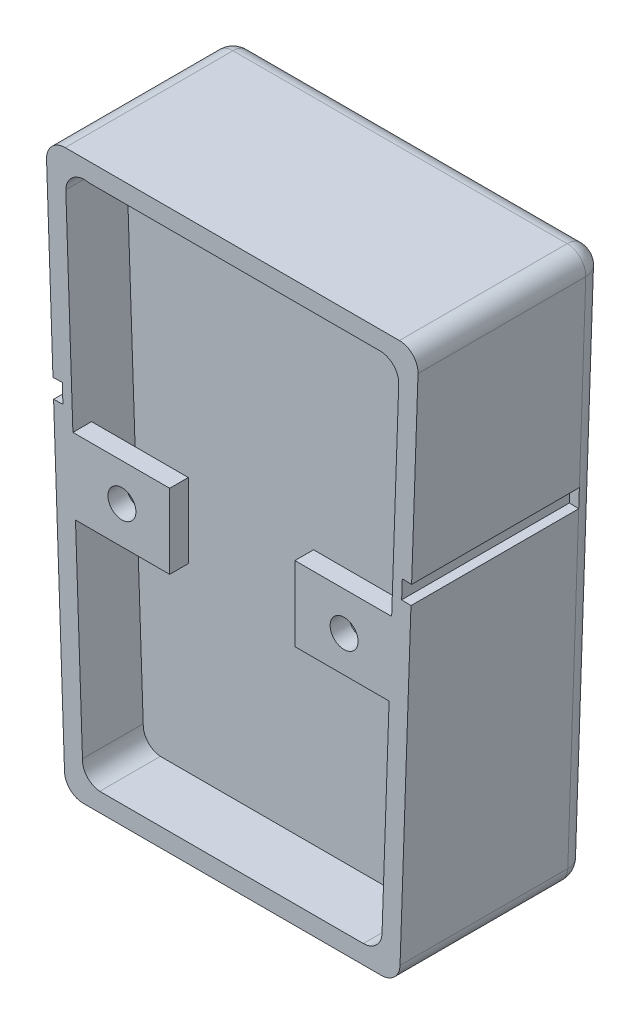
from build123d import *

# Parameters (mm, degrees)
BOSS_EXTRUDE1_DEPTH = 3.81
BOSS_EXTRUDE3_DEPTH = 21.59
BOSS_EXTRUDE4_DEPTH = 2.54
FILLET1_R           = 2.54
BOSS_EXTRUDE6_DEPTH = 2.54
SKETCH9_R           = 1.905
CUT_EXTRUDE1_DEPTH  = 2.54
CUT_EXTRUDE2_DEPTH  = 1.27
SKETCH11_W          = 22.86
SKETCH11_H          = 2.54
CUT_EXTRUDE3_DEPTH  = 1.27
SKETCH12_W          = 22.86
SKETCH12_H          = 2.54
CUT_EXTRUDE4_DEPTH  = 1.27


with BuildPart() as part:
    # Sketch1 → Boss-Extrude1 (new body)
    with BuildSketch(Plane.XY):
        with BuildLine():
            Line((0, 62.289610149), (0, 73.614735329))
            Line((0, 73.614735329), (-19.541270744, 73.614735329))
            ThreePointArc((-19.541270744, 73.614735329), (-21.690891162, 73.166710129), (-22.687990425, 71.210339105))
            Line((-22.687990425, 71.210339105), (-20.412160003, 5.212586245))
            ThreePointArc((-20.412160003, 5.212586245), (-19.78310781, 3.39559701), (-18.061159176, 2.539998129))
            Line((-18.061159176, 2.539998129), (0, 2.539998129))
            Line((0, 2.539998129), (0, 8.872308918))
            ThreePointArc((0, 8.872308918), (-12.75, 21.622308918), (0, 34.372308918))
            Line((0, 34.372308918), (0, 54.789610149))
            ThreePointArc((0, 54.789610149), (-3.75, 58.539610149), (0, 62.289610149))
        make_face()
        with BuildLine():
            Line((20.141804619, 73.614735329), (0, 73.614735329))
            Line((0, 73.614735329), (0, 62.289610149))
            ThreePointArc((0, 62.289610149), (2.651650429, 61.191260578), (3.75, 58.539610149))
            ThreePointArc((3.75, 58.539610149), (2.651650429, 55.887959719), (0, 54.789610149))
            Line((0, 54.789610149), (0, 34.372308918))
            ThreePointArc((0, 34.372308918), (9.01561146, 30.637920378), (12.75, 21.622308918))
            ThreePointArc((12.75, 21.622308918), (9.01561146, 12.606697458), (0, 8.872308918))
            Line((0, 8.872308918), (0, 2.539998129))
            Line((0, 2.539998129), (17.866078187, 2.539998129))
            ThreePointArc((17.866078187, 2.539998129), (19.630909441, 3.253260423), (20.404569365, 4.992462187))
            Line((20.404569365, 4.992462187), (22.680295797, 70.987199387))
            ThreePointArc((22.680295797, 70.987199387), (21.968542325, 72.839566583), (20.141804619, 73.614735329))
        make_face()
        with BuildLine():
            Line((0, 76.154735329), (-22.77090231, 76.154735329))
            ThreePointArc((-22.77090231, 76.154735329), (-24.597640016, 75.379566583), (-25.309393487, 73.527199387))
            Line((-25.309393487, 73.527199387), (-22.858491178, 2.452464058))
            ThreePointArc((-22.858491178, 2.452464058), (-22.084831254, 0.713262294), (-20.32, 0))
            Line((-20.32, 0), (0, 0))
            Line((0, 0), (0, 2.539998129))
            Line((0, 2.539998129), (-18.061159176, 2.539998129))
            ThreePointArc((-18.061159176, 2.539998129), (-19.78310781, 3.39559701), (-20.412160003, 5.212586245))
            Line((-20.412160003, 5.212586245), (-22.687990425, 71.210339105))
            ThreePointArc((-22.687990425, 71.210339105), (-21.690891162, 73.166710129), (-19.541270744, 73.614735329))
            Line((-19.541270744, 73.614735329), (0, 73.614735329))
            Line((0, 73.614735329), (0, 76.154735329))
        make_face()
        with BuildLine():
            Line((22.77090231, 76.154735329), (0, 76.154735329))
            Line((0, 76.154735329), (0, 73.614735329))
            Line((0, 73.614735329), (20.141804619, 73.614735329))
            ThreePointArc((20.141804619, 73.614735329), (21.968542325, 72.839566583), (22.680295797, 70.987199387))
            Line((22.680295797, 70.987199387), (20.404569365, 4.992462187))
            ThreePointArc((20.404569365, 4.992462187), (19.630909441, 3.253260423), (17.866078187, 2.539998129))
            Line((17.866078187, 2.539998129), (0, 2.539998129))
            Line((0, 2.539998129), (0, 0))
            Line((0, 0), (20.32, 0))
            ThreePointArc((20.32, 0), (22.084831254, 0.713262294), (22.858491178, 2.452464058))
            Line((22.858491178, 2.452464058), (25.309393487, 73.527199387))
            ThreePointArc((25.309393487, 73.527199387), (24.597640016, 75.379566583), (22.77090231, 76.154735329))
        make_face()
    extrude(amount=BOSS_EXTRUDE1_DEPTH)

    # Sketch4 → Boss-Extrude3 (add)
    with BuildSketch(Plane.XY.offset(3.81)):
        with BuildLine():
            Line((-22.77090231, 76.154735329), (22.77090231, 76.154735329))
            ThreePointArc((22.77090231, 76.154735329), (24.597640016, 75.379566583), (25.309393487, 73.527199387))
            Line((25.309393487, 73.527199387), (22.858491178, 2.452464058))
            ThreePointArc((22.858491178, 2.452464058), (22.084831254, 0.713262294), (20.32, 0))
            Line((20.32, 0), (-20.32, 0))
            ThreePointArc((-20.32, 0), (-22.084831254, 0.713262294), (-22.858491178, 2.452464058))
            Line((-22.858491178, 2.452464058), (-25.309393487, 73.527199387))
            ThreePointArc((-25.309393487, 73.527199387), (-24.597640016, 75.379566583), (-22.77090231, 76.154735329))
        make_face()
        with BuildLine():
            Line((-19.541270744, 73.614735329), (20.141804619, 73.614735329))
            ThreePointArc((20.141804619, 73.614735329), (21.968542325, 72.839566583), (22.680295797, 70.987199387))
            Line((22.680295797, 70.987199387), (20.404569365, 4.992462187))
            ThreePointArc((20.404569365, 4.992462187), (19.630909441, 3.253260423), (17.866078187, 2.539998129))
            Line((17.866078187, 2.539998129), (-18.061159176, 2.539998129))
            ThreePointArc((-18.061159176, 2.539998129), (-19.78310781, 3.39559701), (-20.412160003, 5.212586245))
            Line((-20.412160003, 5.212586245), (-22.687990425, 71.210339105))
            ThreePointArc((-22.687990425, 71.210339105), (-21.690891162, 73.166710129), (-19.541270744, 73.614735329))
        make_face(mode=Mode.SUBTRACT)
    extrude(amount=BOSS_EXTRUDE3_DEPTH)

    # Sketch7 → Boss-Extrude4 (add)
    with BuildSketch(Plane.XY.offset(14.605)):
        with BuildLine():
            Line((-19.537731311, 73.614735329), (20.145344052, 73.614735329))
            ThreePointArc((20.145344052, 73.614735329), (21.972081758, 72.839566583), (22.68383523, 70.987199387))
            Line((22.68383523, 70.987199387), (20.408108798, 4.992462187))
            ThreePointArc((20.408108798, 4.992462187), (19.634448874, 3.253260423), (17.86961762, 2.539998129))
            Line((17.86961762, 2.539998129), (-18.057619743, 2.539998129))
            ThreePointArc((-18.057619743, 2.539998129), (-19.730779532, 3.364707915), (-20.389382819, 5.109944754))
            Line((-20.389382819, 5.109944754), (-22.665213241, 71.107697614))
            ThreePointArc((-22.665213241, 71.107697614), (-21.714144758, 73.125513756), (-19.537731311, 73.614735329))
        make_face()
    extrude(amount=BOSS_EXTRUDE4_DEPTH)

    # Fillet1
    fillet1_edges = [part.edges().sort_by_distance(p)[0] for p in [
        (-22.084831254, 0.713262294, 0),
        (-24.083942332, 37.989831723, 0),
        (-24.597640016, 75.379566583, 0),
        (0, 76.154735329, 0),
        (24.597640016, 75.379566583, 0),
        (24.083942332, 37.989831723, 0),
        (22.084831254, 0.713262294, 0),
        (0, 0, 0),
    ]]
    fillet(fillet1_edges, radius=FILLET1_R)

    # Sketch8 → Boss-Extrude6 (add)
    with BuildSketch(Plane.XY.offset(25.4)):
        Polygon((-21.717608556, 43.069831723), (-8.531459132, 43.069831723), (-8.531459132, 32.909831723), (-21.367256671, 32.909831723), align=None)
        Polygon((8.531459132, 32.909831723), (21.367256671, 32.909831723), (21.717608556, 43.069831723), (8.531459132, 43.069831723), align=None)
    extrude(amount=-BOSS_EXTRUDE6_DEPTH)

    # Sketch9 → Cut-Extrude1 (cut)
    with BuildSketch(Plane.XY.offset(25.4)):
        with Locations((-15.036945873, 37.989831723)):
            Circle(SKETCH9_R)
        with Locations(Location((15.237744036, 37.820383377, 0), (0, 0, 180))):
            Circle(SKETCH9_R)
    extrude(amount=-CUT_EXTRUDE1_DEPTH, mode=Mode.SUBTRACT)

    # Sketch10 → Cut-Extrude2 (cut)
    with BuildSketch(Plane(origin=(0, 0, 0), x_dir=(-1, 0, 0), z_dir=(0, 0, -1))):
        Polygon((-21.897084176, 48.274519863), (21.897084176, 48.274519863), (21.809496204, 45.734519863), (-21.809496204, 45.734519863), align=None)
    extrude(amount=-CUT_EXTRUDE2_DEPTH, mode=Mode.SUBTRACT)

    # Sketch11 → Cut-Extrude3 (cut)
    with BuildSketch(Plane(origin=(-22.746873247, -0.784390739, 0), x_dir=(0, 0, 1), z_dir=(-0.9994059754448638, -0.03446296918579016, 0))):
        with Locations((13.97, 47.745550873)):
            Rectangle(SKETCH11_W, SKETCH11_H)
    extrude(amount=-CUT_EXTRUDE3_DEPTH, mode=Mode.SUBTRACT)

    # Sketch12 → Cut-Extrude4 (cut)
    with BuildSketch(Plane(origin=(22.746873247, -0.784390739, 0), x_dir=(0, 0, -1), z_dir=(0.9994059754448638, -0.034462969185789866, 0))):
        with Locations((-13.97, 47.745550873)):
            Rectangle(SKETCH12_W, SKETCH12_H)
    extrude(amount=-CUT_EXTRUDE4_DEPTH, mode=Mode.SUBTRACT)


solid = part.part
